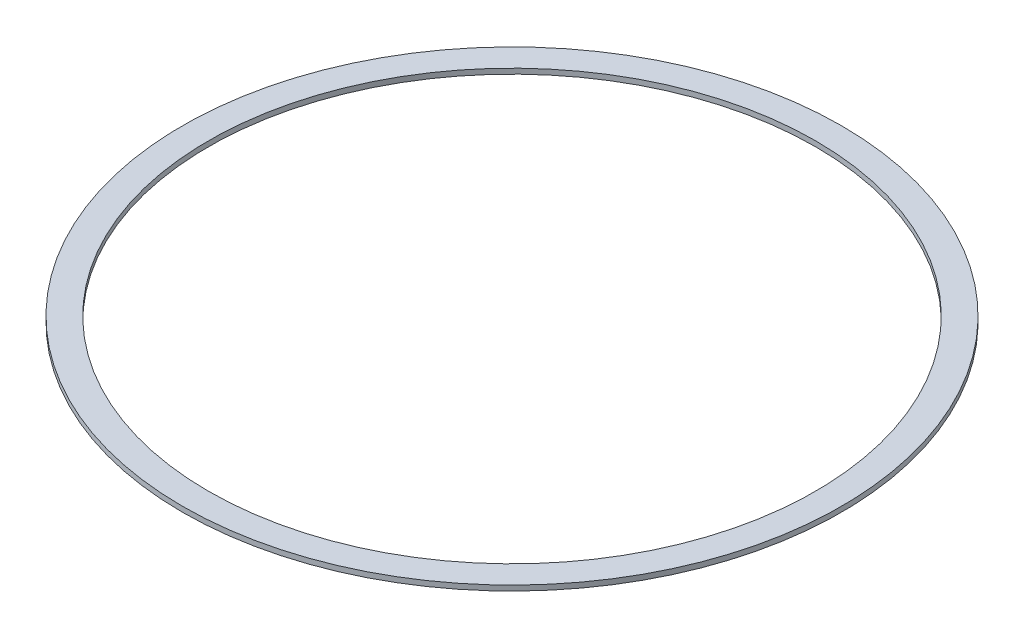
from build123d import *

# Parameters (mm, degrees)
SKETCH1_R           = 190
SKETCH1_R_2         = 175
BOSS_EXTRUDE1_DEPTH = 1.5


with BuildPart() as part:
    # Sketch1 → Boss-Extrude1 (new, symmetric)
    with BuildSketch(Plane(origin=(0, 0, 0), x_dir=(1, 0, 0), z_dir=(0, 1, 0))):
        with Locations(Location((0, 0, 0), (0, 0, 270))):
            Circle(SKETCH1_R)
        with Locations(Location((0, 0, 0), (0, 0, 270))):
            Circle(SKETCH1_R_2, mode=Mode.SUBTRACT)
    extrude(amount=BOSS_EXTRUDE1_DEPTH, both=True)


solid = part.part
